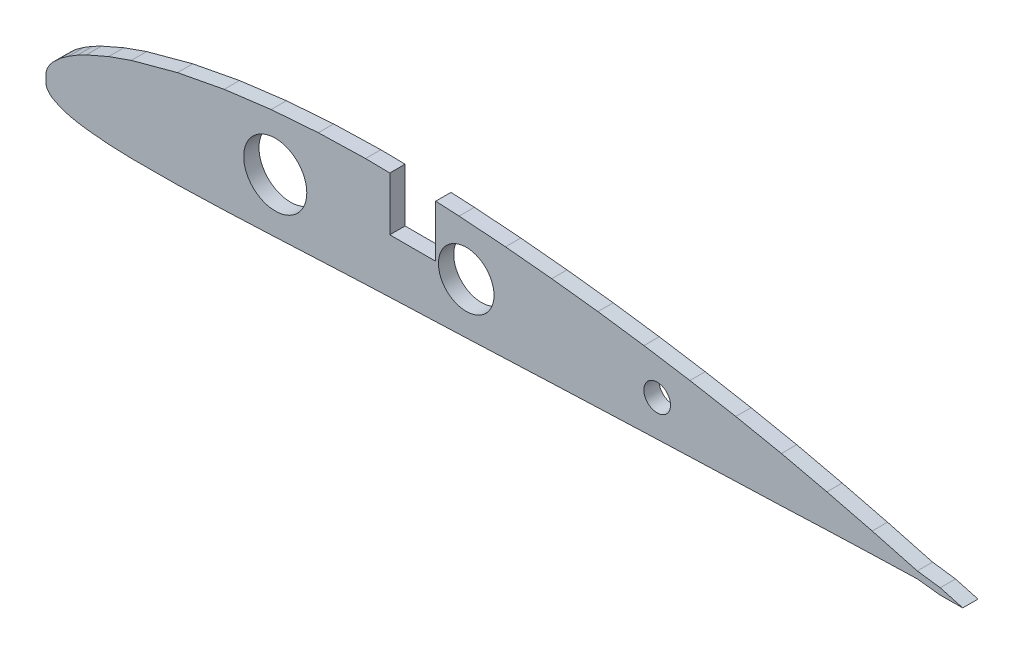
from build123d import *

# Parameters (mm, degrees)
EXTRUDE_1_DEPTH     = 4
SKETCH_2_R          = 8.2578
CUT_EXTRUDE_1_DEPTH = 242.202090903
SKETCH_3_W          = 12
SKETCH_3_H          = 15
CUT_EXTRUDE_2_DEPTH = 242.202090903
SKETCH_4_R          = 7.273
CUT_EXTRUDE_3_DEPTH = 242.202090903
SKETCH_5_R          = 3.493
CUT_EXTRUDE_4_DEPTH = 242.202090903


with BuildPart() as part:
    # 草图1 → 凸台-拉伸1 (new body)
    with BuildSketch(Plane.XY):
        Polygon((0, 0), (-0.022, 1.356), (0.112, 1.935), (0.273, 2.386), (0.631, 3.114), (1.112, 3.853), (1.618, 4.487), (3.738, 6.498), (5.954, 8.087), (8.221, 9.446), (10.524, 10.652), (16.38, 13.212), (22.333, 15.314), (34.409, 18.579), (46.63, 20.902), (58.933, 22.468), (71.28, 23.384), (83.643, 23.716), (96, 23.519), (108.149, 22.918), (120.282, 22.016), (132.395, 20.844), (144.485, 19.431), (156.547, 17.759), (168.577, 15.85), (180.573, 13.692), (192.529, 11.275), (204.433, 8.534), (216.296, 5.59), (228.111, 2.437), (234.107, 1.62), (240, 0), (234.107, -0.054), (228.111, 0.629), (216.296, 0.276), (204.433, -0.134), (192.529, -0.609), (180.573, -1.026), (168.577, -1.45), (156.547, -1.893), (144.485, -2.365), (132.395, -2.844), (120.282, -3.35), (108.149, -3.852), (96, -4.319), (83.643, -4.816), (71.28, -5.384), (58.933, -5.968), (46.63, -6.502), (34.409, -6.879), (22.333, -6.914), (16.38, -6.687), (10.524, -6.152), (8.221, -5.798), (5.954, -5.315), (3.738, -4.626), (1.618, -3.539), (1.112, -3.14), (0.631, -2.636), (0.273, -2.099), (0.112, -1.743), (-0.022, -1.26), align=None)
    extrude(amount=EXTRUDE_1_DEPTH)

    # 草图2 → 切除-拉伸1 (cut, through all)
    with BuildSketch(Plane.XY):
        with Locations((60, 8.25)):
            Circle(SKETCH_2_R)
    extrude(amount=CUT_EXTRUDE_1_DEPTH, mode=Mode.SUBTRACT)

    # 草图3 → 切除-拉伸2 (cut, through all)
    with BuildSketch(Plane.XY):
        with Locations((96, 17.1)):
            Rectangle(SKETCH_3_W, SKETCH_3_H)
    extrude(amount=CUT_EXTRUDE_2_DEPTH, mode=Mode.SUBTRACT)

    # 草图4 → 切除-拉伸3 (cut, through all)
    with BuildSketch(Plane.XY):
        with Locations((110, 9.5093)):
            Circle(SKETCH_4_R)
    extrude(amount=CUT_EXTRUDE_3_DEPTH, mode=Mode.SUBTRACT)

    # 草图5 → 切除-拉伸4 (cut, through all)
    with BuildSketch(Plane.XY):
        with Locations((160, 7.7037)):
            Circle(SKETCH_5_R)
    extrude(amount=CUT_EXTRUDE_4_DEPTH, mode=Mode.SUBTRACT)


solid = part.part
